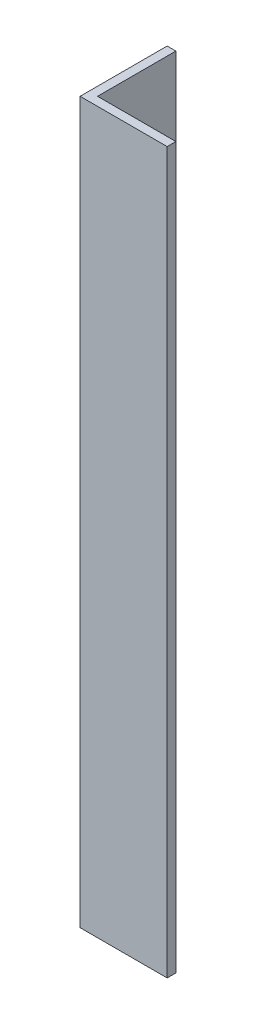
from build123d import *

# Parameters (mm, degrees)
BOSS_EXTRUDE1_DEPTH = 248


with BuildPart() as part:
    # Sketch1 → Boss-Extrude1 (new body)
    with BuildSketch(Plane(origin=(0, 0, 0), x_dir=(1, 0, 0), z_dir=(0, 1, 0))):
        Polygon((-12, -12), (-12, 12), (-12, 15), (-15, 15), (-15, -15), (15, -15), (15, -12), (12, -12), align=None)
    extrude(amount=BOSS_EXTRUDE1_DEPTH)


solid = part.part
